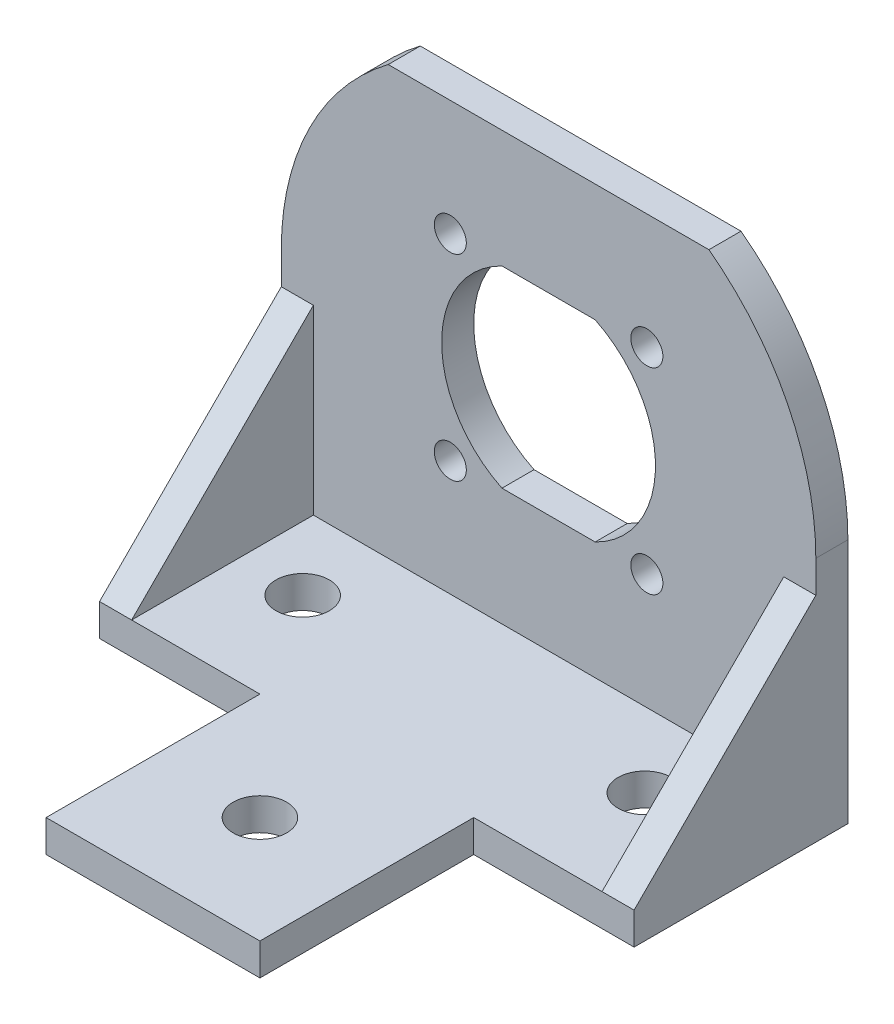
from build123d import *

# Parameters (mm, degrees)
SKETCH1_W           = 50
SKETCH1_H           = 20
BOSS_EXTRUDE1_DEPTH = 3
SKETCH2_W           = 50
SKETCH2_H           = 3
BOSS_EXTRUDE2_DEPTH = 40
CUT_EXTRUDE4_REACH  = 50.218
SKETCH6_R           = 2.5
BOSS_EXTRUDE3_DEPTH = 3
BOSS_EXTRUDE4_DEPTH = 3
SKETCH9_W           = 20
SKETCH9_H           = 3
BOSS_EXTRUDE5_DEPTH = 20
CUT_EXTRUDE5_REACH  = 57.902
SKETCH10_R          = 2.5
SKETCH11_R          = 1.5
CUT_EXTRUDE6_DEPTH  = 3


with BuildPart() as part:
    # Sketch1 → Boss-Extrude1 (new body)
    with BuildSketch(Plane(origin=(0, 0, 0), x_dir=(1, 0, 0), z_dir=(0, 1, 0))):
        Rectangle(SKETCH1_W, SKETCH1_H)
    extrude(amount=BOSS_EXTRUDE1_DEPTH)

    # Sketch2 → Boss-Extrude2 (add)
    with BuildSketch(Plane(origin=(0, 3, 0), x_dir=(1, 0, 0), z_dir=(0, 1, 0))):
        with Locations((0, 8.5)):
            Rectangle(SKETCH2_W, SKETCH2_H)
    extrude(amount=BOSS_EXTRUDE2_DEPTH)

    # Sketch6 → Cut-Extrude4 (cut, up to next)
    with BuildSketch(Plane(origin=(0, 3, 0), x_dir=(1, 0, 0), z_dir=(0, 1, 0)), mode=Mode.PRIVATE) as cut_extrude4_sk1:
        with Locations(Location((-16, 0, 0), (0, 0, 270))):
            Circle(SKETCH6_R)
    cut_extrude4_tool1 = extrude(cut_extrude4_sk1.sketch, amount=-CUT_EXTRUDE4_REACH, mode=Mode.PRIVATE) & part.part
    # Sketch6 → Cut-Extrude4 (cut, up to next)
    with BuildSketch(Plane(origin=(0, 3, 0), x_dir=(1, 0, 0), z_dir=(0, 1, 0)), mode=Mode.PRIVATE) as cut_extrude4_sk2:
        with Locations(Location((16, 0, 0), (0, 0, 270))):
            Circle(SKETCH6_R)
    cut_extrude4_tool2 = extrude(cut_extrude4_sk2.sketch, amount=-CUT_EXTRUDE4_REACH, mode=Mode.PRIVATE) & part.part
    add(cut_extrude4_tool1.solids().sort_by_distance((-16, 3, 0))[0], mode=Mode.SUBTRACT)
    add(cut_extrude4_tool2.solids().sort_by_distance((16, 3, 0))[0], mode=Mode.SUBTRACT)

    # Sketch7 → Boss-Extrude3 (add)
    with BuildSketch(Plane.ZY.offset(25)):
        Polygon((-7, 3), (10, 3), (-7, 20), align=None)
    extrude(amount=-BOSS_EXTRUDE3_DEPTH)

    # Sketch8 → Boss-Extrude4 (add)
    with BuildSketch(Plane(origin=(25, 0, 0), x_dir=(0, 0, -1), z_dir=(1, 0, 0))):
        Polygon((7, 3), (-10, 3), (7, 20), align=None)
    extrude(amount=-BOSS_EXTRUDE4_DEPTH)

    # Sketch9 → Boss-Extrude5 (add)
    with BuildSketch(Plane.XY.offset(10)):
        with Locations((0, 1.5)):
            Rectangle(SKETCH9_W, SKETCH9_H)
    extrude(amount=BOSS_EXTRUDE5_DEPTH)

    # Sketch10 → Cut-Extrude5 (cut, up to next)
    with BuildSketch(Plane(origin=(0, 3, 0), x_dir=(1, 0, 0), z_dir=(0, 1, 0)), mode=Mode.PRIVATE) as cut_extrude5_sk1:
        with Locations(Location((0, -20, 0), (0, 0, 270))):
            Circle(SKETCH10_R)
    cut_extrude5_tool1 = extrude(cut_extrude5_sk1.sketch, amount=-CUT_EXTRUDE5_REACH, mode=Mode.PRIVATE) & part.part
    add(cut_extrude5_tool1.solids().sort_by_distance((0, 3, 20))[0], mode=Mode.SUBTRACT)

    # Sketch11 → Cut-Extrude6 (cut)
    with BuildSketch(Plane.XY.offset(-7)):
        with Locations((9.192388155, 32.192388155)):
            Circle(SKETCH11_R)
        with Locations((9.192388155, 13.807611845)):
            Circle(SKETCH11_R)
        with Locations((-9.192388155, 13.807611845)):
            Circle(SKETCH11_R)
        with Locations((-9.192388155, 32.192388155)):
            Circle(SKETCH11_R)
        with BuildLine():
            Line((15, 43), (25, 43))
            Line((25, 43), (25, 23))
            ThreePointArc((25, 23), (22.360679775, 34.180339887), (15, 43))
        make_face()
        with BuildLine():
            Line((-15, 43), (-25, 43))
            Line((-25, 43), (-25, 23))
            ThreePointArc((-25, 23), (-22.360679775, 34.180339887), (-15, 43))
        make_face()
        with BuildLine():
            Line((-4.358898944, 32), (4.358898944, 32))
            ThreePointArc((4.358898944, 32), (10, 23), (4.358898944, 14))
            Line((4.358898944, 14), (-4.358898944, 14))
            ThreePointArc((-4.358898944, 14), (-10, 23), (-4.358898944, 32))
        make_face()
    extrude(amount=-CUT_EXTRUDE6_DEPTH, mode=Mode.SUBTRACT)


solid = part.part
